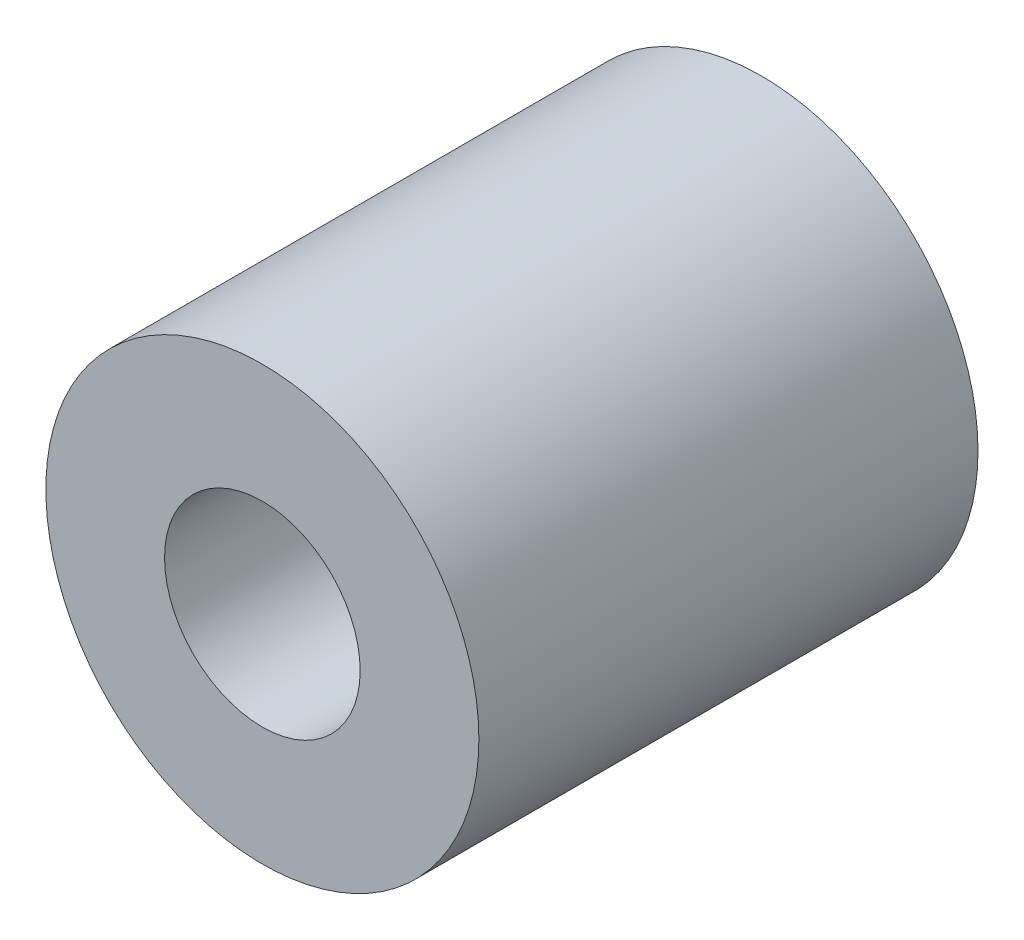
from build123d import *

# Parameters (mm, degrees)
SKETCH1_R           = 5.7912
SKETCH1_R_2         = 2.6162
BOSS_EXTRUDE1_DEPTH = 13.349986


with BuildPart() as part:
    # Sketch1 → Boss-Extrude1 (new body)
    with BuildSketch(Plane.XY):
        Circle(SKETCH1_R)
        Circle(SKETCH1_R_2, mode=Mode.SUBTRACT)
    extrude(amount=BOSS_EXTRUDE1_DEPTH)


solid = part.part
